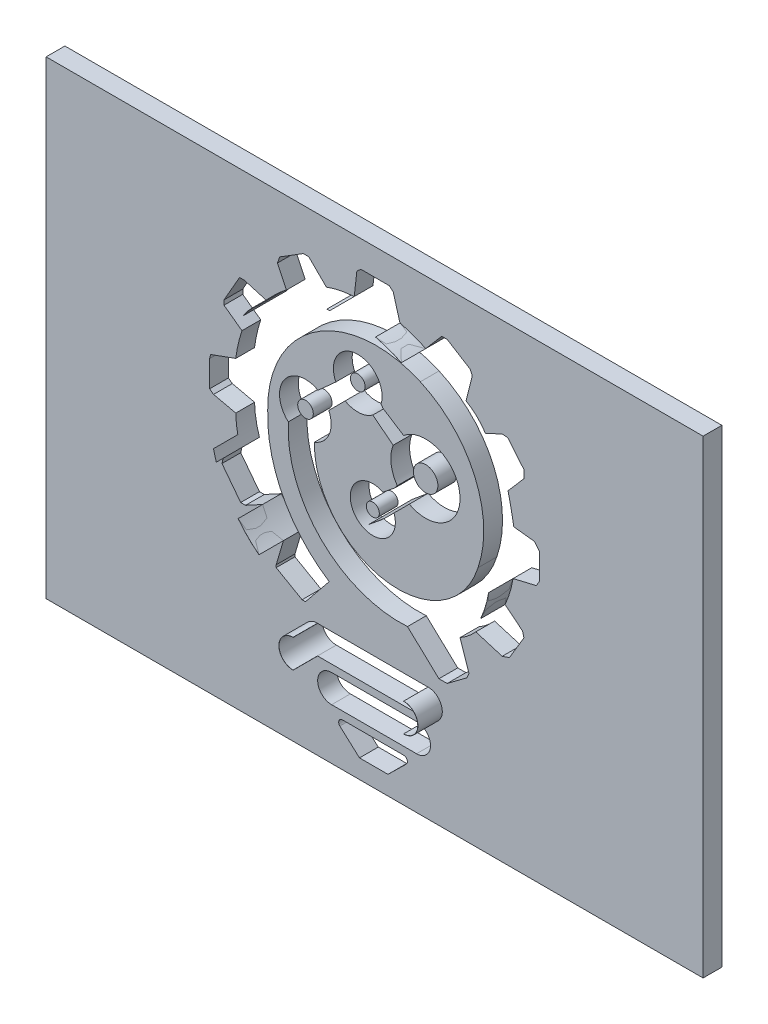
from build123d import *

# Parameters (mm, degrees)
BOSS_EXTRUDE1_DEPTH   = 10
BOSS_EXTRUDE1_2_DEPTH = 10
BOSS_EXTRUDE1_3_DEPTH = 10
SKETCH1_R             = 1.735714146
SKETCH1_R_2           = 3.25388296
SKETCH1_R_3           = 1.963199763
SKETCH1_R_4           = 2.077188844
BOSS_EXTRUDE1_4_DEPTH = 10
CUT_EXTRUDE2_DEPTH    = 3.5
SKETCH3_W             = 175
SKETCH3_H             = 125
BOSS_EXTRUDE2_DEPTH   = 5
CUT_EXTRUDE3_START    = -56
SKETCH4_R             = 2.077188844
SKETCH4_R_2           = 1.963199763
SKETCH4_R_3           = 3.25388296
SKETCH4_R_4           = 1.735714146
CUT_EXTRUDE3_DEPTH    = 56
SKETCH5_W             = 29.451232435
SKETCH5_H             = 6.5
CUT_EXTRUDE4_DEPTH    = 50


with BuildPart() as part:
    # Sketch1 → Boss-Extrude1 (new body)
    with BuildSketch(Plane.XY):
        with BuildLine():
            Line((36.612676513, 50.128115897), (66.063908948, 50.128115897))
            ThreePointArc((66.063908948, 50.128115897), (69.85606523, 46.335959615), (66.063908948, 42.543803333))
            Line((66.063908948, 42.543803333), (36.612676513, 42.543803333))
            ThreePointArc((36.612676513, 42.543803333), (32.82052023, 46.335959615), (36.612676513, 50.128115897))
        make_face()
    extrude(amount=BOSS_EXTRUDE1_DEPTH)



with BuildPart() as body_2:
    # Sketch1 → Boss-Extrude1 2 (new body)
    with BuildSketch(Plane.XY):
        with BuildLine():
            Line((40.371121954, 40.631857622), (62.992183574, 40.631857622))
            ThreePointArc((62.992183574, 40.631857622), (66.703998638, 36.920042558), (62.992183574, 33.208227494))
            Line((62.992183574, 33.208227494), (40.371121954, 33.208227494))
            ThreePointArc((40.371121954, 33.208227494), (36.65930689, 36.920042558), (40.371121954, 40.631857622))
        make_face()
    extrude(amount=BOSS_EXTRUDE1_2_DEPTH)


with BuildPart() as body_3:
    # Sketch1 → Boss-Extrude1 3 (new body)
    with BuildSketch(Plane.XY):
        with BuildLine():
            Line((43.291590681, 31.145459419), (59.548762461, 31.145459419))
            ThreePointArc((59.548762461, 31.145459419), (60.47915555, 30.526270831), (60.255275906, 29.431326214))
            Line((60.255275906, 29.431326214), (55.380256876, 24.642590707))
            Line((55.380256876, 24.642590707), (47.793576713, 24.642590707))
            Line((47.793576713, 24.642590707), (42.554783621, 29.366497269))
            ThreePointArc((42.554783621, 29.366497269), (42.328835394, 30.502145791), (43.291590681, 31.145459419))
        make_face()
    extrude(amount=BOSS_EXTRUDE1_3_DEPTH)


with BuildPart() as body_4:
    # Sketch1 → Boss-Extrude1 4 (new body)
    with BuildSketch(Plane.XY):
        with BuildLine():
            Line((54.042424699, 89.057178574), (57.338263311, 91.74525403))
            Line((57.338263311, 91.74525403), (57.858109934, 92.482001406))
            ThreePointArc((57.858109934, 92.482001406), (56.203750586, 96.735543385), (56.775287603, 101.263552843))
            Line((56.775287603, 101.263552843), (51.33821868, 105.502853511))
            ThreePointArc((51.33821868, 105.502853511), (47.717753365, 104.214223221), (43.975219744, 105.087022863))
            Line((43.975219744, 105.087022863), (39.619407743, 100.731210862))
            ThreePointArc((39.619407743, 100.731210862), (39.726080925, 95.257490785), (35.780591664, 91.461953256))
            ThreePointArc((35.780591664, 91.461953256), (54.470931261, 69.004961782), (79.367543752, 84.29561078))
            ThreePointArc((79.367543752, 84.29561078), (78.518157241, 104.885379157), (63.999024785, 119.509154728))
            ThreePointArc((63.999024785, 119.509154728), (36.348842887, 117.238880972), (23.350287639, 92.729204038))
            ThreePointArc((23.350287639, 92.729204038), (27.391085677, 74.838212259), (39.726172291, 61.263925027))
            Line((39.726172291, 61.263925027), (33.41222021, 53.484864806))
            Line((33.41222021, 53.484864806), (32.501801001, 53.484864806))
            Line((32.501801001, 53.484864806), (25.600419414, 57.431311375))
            Line((25.600419414, 57.431311375), (25.600419414, 58.091089656))
            Line((25.600419414, 58.091089656), (27.529461306, 64.624845993))
            add(Edge.make_bspline(
                [(27.529461306, 64.624845993), (24.51350433, 66.863878585), (21.96798092, 70.186326379)],
                knots=[0, 0, 0, 1, 1, 1], degree=2))
            Line((21.96798092, 70.186326379), (17.44826512, 67.73638598))
            Line((17.44826512, 67.73638598), (16.147653792, 67.73638598))
            Line((16.147653792, 67.73638598), (11.164001938, 74.227807572))
            Line((11.164001938, 74.227807572), (11.478280842, 75.608236048))
            Line((11.478280842, 75.608236048), (16.147653792, 80.277608998))
            add(Edge.make_bspline(
                [(14.836422664, 87.711108712), (14.969965726, 83.721585295), (16.147653792, 80.277608998)],
                knots=[0, 0, 0, 1, 1, 1], degree=2))
            Line((14.836422664, 87.711108712), (8.923989025, 89.057178574))
            Line((8.923989025, 89.057178574), (7.872310913, 89.823022551))
            Line((7.872310913, 89.823022551), (7.872310913, 96.783792065))
            Line((7.872310913, 96.783792065), (8.120139021, 97.872344214))
            Line((8.120139021, 97.872344214), (14.836422664, 100.309725684))
            ThreePointArc((14.836422664, 100.309725684), (15.482642582, 103.966872263), (16.483280209, 107.543329397))
            Line((16.483280209, 107.543329397), (11.70192116, 111.025169506))
            Line((11.70192116, 111.025169506), (11.70192116, 112.254374343))
            Line((11.70192116, 112.254374343), (15.850453276, 119.509154728))
            Line((15.850453276, 119.509154728), (17.116107143, 119.509154728))
            Line((17.116107143, 119.509154728), (23.350287639, 117.668560326))
            add(Edge.make_bspline(
                [(28.34341676, 122.838084344), (25.083188206, 120.541403415), (23.350287639, 117.668560326)],
                knots=[0, 0, 0, 1, 1, 1], degree=2))
            Line((28.34341676, 122.838084344), (25.924430047, 127.860583288))
            Line((25.924430047, 127.860583288), (26.55905403, 129.601522707))
            Line((26.55905403, 129.601522707), (32.835382419, 133.499504209))
            Line((32.835382419, 133.499504209), (34.268559767, 133.499504209))
            Line((34.268559767, 133.499504209), (38.960915607, 128.841575946))
            add(Edge.make_bspline(
                [(46.383652832, 130.361469468), (43.207748731, 130.193389879), (38.960915607, 128.841575946)],
                knots=[0, 0, 0, 1, 1, 1], degree=2))
            Line((46.383652832, 130.361469468), (47.099801145, 136.637538949))
            Line((47.099801145, 136.637538949), (48.204973985, 137.54371488))
            Line((48.204973985, 137.54371488), (55.716804255, 137.54371488))
            Line((55.716804255, 137.54371488), (56.775287603, 136.637538949))
            Line((56.775287603, 136.637538949), (58.560830407, 130.361469468))
            add(Edge.make_bspline(
                [(65.42141471, 127.860583288), (62.762273281, 129.346820645), (58.560830407, 130.361469468)],
                knots=[0, 0, 0, 1, 1, 1], degree=2))
            Line((65.42141471, 127.860583288), (69.703471426, 132.862355649))
            Line((69.703471426, 132.862355649), (71.141353612, 132.862355649))
            Line((71.141353612, 132.862355649), (77.253367018, 129.076282377))
            Line((77.253367018, 129.076282377), (77.838884302, 127.860583288))
            Line((77.838884302, 127.860583288), (76.183025885, 121.169766859))
            add(Edge.make_bspline(
                [(76.183025885, 121.169766859), (79.253811261, 119.413315061), (81.326289538, 116.311143396)],
                knots=[0, 0, 0, 1, 1, 1], degree=2))
            Line((81.326289538, 116.311143396), (81.695672628, 116.410742944))
            Line((81.695672628, 116.410742944), (85.815355288, 118.394906151))
            Line((85.815355288, 118.394906151), (87.360330483, 118.218612472))
            Line((87.360330483, 118.218612472), (91.659132082, 112.975790841))
            Line((91.659132082, 112.975790841), (91.659132082, 111.025169506))
            Line((91.659132082, 111.025169506), (87.360330483, 106.045624317))
            Line((87.360330483, 106.045624317), (88.905274365, 98.500548104))
            Line((88.905274365, 98.500548104), (94.4129898, 97.87207496))
            Line((94.4129898, 97.87207496), (95.767055319, 96.21186062))
            Line((95.767055319, 96.21186062), (95.767055319, 89.382694603))
            Line((95.767055319, 89.382694603), (94.909859849, 87.946746758))
            Line((94.909859849, 87.946746758), (88.683296287, 86.458456895))
            add(Edge.make_bspline(
                [(88.683296287, 86.458456895), (88.100618882, 82.748375774), (86.564981896, 79.397644229)],
                knots=[0, 0, 0, 1, 1, 1], degree=2))
            Line((86.564981896, 79.397644229), (91.245566834, 75.624301928))
            Line((91.245566834, 75.624301928), (91.598019479, 74.227807572))
            Line((91.598019479, 74.227807572), (87.722936412, 67.73638598))
            Line((87.722936412, 67.73638598), (85.815355288, 67.093511057))
            Line((85.815355288, 67.093511057), (78.775745724, 69.205464306))
            add(Edge.make_bspline(
                [(78.775745724, 69.205464306), (76.888993362, 67.188035301), (74.572909919, 65.777644834)],
                knots=[0, 0, 0, 1, 1, 1], degree=2))
            Line((74.572909919, 65.777644834), (76.954362748, 58.711239992))
            Line((76.954362748, 58.711239992), (76.421059157, 57.431311375))
            Line((76.421059157, 57.431311375), (71.141353612, 53.484864806))
            Line((71.141353612, 53.484864806), (68.954808891, 53.484864806))
            Line((68.954808891, 53.484864806), (60.578889007, 61.332051704))
            ThreePointArc((60.578889007, 61.332051704), (37.638360698, 69.85475845), (28.834470871, 92.688853424))
            ThreePointArc((28.834470871, 92.688853424), (27.758447656, 101.854708046), (36.751263907, 103.928345615))
            Line((36.751263907, 103.928345615), (41.493079417, 108.204751423))
            ThreePointArc((41.493079417, 108.204751423), (46.823385651, 117.490522776), (53.542937831, 109.154736511))
            Line((53.542937831, 109.154736511), (54.042232948, 108.423261616))
            Line((54.042232948, 108.423261616), (59.548581239, 104.89051106))
            ThreePointArc((59.548581239, 104.89051106), (74.526662809, 98.789825799), (61.067178135, 89.823022551))
            Line((61.067178135, 89.823022551), (60.090678716, 88.942366655))
            Line((60.090678716, 88.942366655), (56.775372182, 86.238413225))
            ThreePointArc((56.775372182, 86.238413225), (47.03062353, 79.524599219), (54.042424699, 89.057178574))
        make_face()
        with Locations((51.33830326, 83.70113079)):
            Circle(SKETCH1_R, mode=Mode.SUBTRACT)
        with Locations((65.42141471, 97.872141243)):
            Circle(SKETCH1_R_2, mode=Mode.SUBTRACT)
        with Locations((47.333100287, 111.025169506)):
            Circle(SKETCH1_R_3, mode=Mode.SUBTRACT)
        with Locations((33.41222021, 97.872344214)):
            Circle(SKETCH1_R_4, mode=Mode.SUBTRACT)
    extrude(amount=BOSS_EXTRUDE1_4_DEPTH)

    # Sketch2 → Cut-Extrude2 (cut)
    with BuildSketch(Plane(origin=(0, 0, 0), x_dir=(-1, 0, 0), z_dir=(0, 0, -1))):
        with BuildLine():
            Line((-36.882576832, 101.353568923), (-42.290231098, 106.230461342))
            Line((-42.290231098, 106.230461342), (-37.080357203, 101.020587447))
            ThreePointArc((-37.080357203, 101.020587447), (-37.893710893, 96.06046516), (-33.861615538, 93.059371298))
            ThreePointArc((-33.861615538, 93.059371298), (-53.367472026, 67.172595862), (-81.267551741, 83.670751264))
            ThreePointArc((-81.267551741, 83.670751264), (-80.346652287, 105.695765365), (-64.812170652, 121.336391385))
            ThreePointArc((-64.812170652, 121.336391385), (-35.268906863, 118.922417224), (-21.349861224, 92.751978269))
            ThreePointArc((-21.349861224, 92.751978269), (-25.129717063, 74.884715442), (-36.81226348, 60.847461425))
            Line((-36.81226348, 60.847461425), (-32.641490793, 55.708890291))
            Line((-32.641490793, 55.708890291), (-27.799852639, 58.477504958))
            Line((-27.799852639, 58.477504958), (-29.856074316, 65.442025158))
            add(Edge.make_bspline(
                [(-29.856074316, 65.442025158), (-29.175521421, 65.883970458), (-27.879064513, 66.83183634), (-26.00235788, 68.531221621), (-24.519885547, 70.169582429), (-23.383769421, 71.61199016), (-22.824457002, 72.38961669), (-22.555784216, 72.779877494)],
                knots=[0.500282491, 0.500282491, 0.500282491, 0.500282491, 0.500474616, 0.500666741, 0.500858866, 0.500954928, 0.501050991, 0.501050991, 0.501050991, 0.501050991], degree=3))
            Line((-22.555784216, 72.779877494), (-17.0770441, 69.810091883))
            Line((-17.0770441, 69.810091883), (-13.355732604, 74.657260685))
            Line((-13.355732604, 74.657260685), (-18.472416218, 79.773944264))
            add(Edge.make_bspline(
                [(-18.472416218, 79.773944264), (-18.180879786, 80.48416116), (-17.682088455, 81.925076377), (-17.152529334, 84.237432109), (-16.903073855, 86.281021736), (-16.819114201, 87.983569854), (-16.816446117, 88.87065466), (-16.824762225, 89.309605882)],
                knots=[0.500152836, 0.500152836, 0.500152836, 0.500152836, 0.500341207, 0.500529579, 0.500717951, 0.500812137, 0.500906323, 0.500906323, 0.500906323, 0.500906323], degree=3))
            Line((-16.824762225, 89.309605882), (-9.872310913, 90.892454127))
            Line((-9.872310913, 90.892454127), (-9.872310913, 96.380589694))
            Line((-9.872310913, 96.380589694), (-16.688696078, 98.854298633))
            ThreePointArc((-16.688696078, 98.854298633), (-17.459873001, 103.641146011), (-18.868263889, 108.280656412))
            Line((-18.868263889, 108.280656412), (-13.83108217, 111.948789503))
            Line((-13.83108217, 111.948789503), (-16.984161581, 117.462763608))
            Line((-16.984161581, 117.462763608), (-24.362840661, 115.284264699))
            add(Edge.make_bspline(
                [(-24.362840661, 115.284264699), (-24.646652824, 115.933709084), (-25.322213081, 117.159331227), (-26.734958109, 118.921539462), (-28.263474131, 120.307897606), (-29.694417524, 121.359457035), (-30.504172759, 121.879036013), (-30.908098275, 122.122180546)],
                knots=[0.500066259, 0.500066259, 0.500066259, 0.500066259, 0.50030451, 0.500542761, 0.500781012, 0.500900138, 0.501019263, 0.501019263, 0.501019263, 0.501019263], degree=3))
            Line((-30.908098275, 122.122180546), (-28.092433001, 127.968296092))
            Line((-28.092433001, 127.968296092), (-28.20138546, 128.267181157))
            Line((-28.20138546, 128.267181157), (-33.405905009, 131.499504209))
            Line((-33.405905009, 131.499504209), (-33.444443051, 131.499504209))
            Line((-33.444443051, 131.499504209), (-38.424034638, 126.556447474))
            add(Edge.make_bspline(
                [(-38.424034638, 126.556447474), (-38.923711949, 126.728684385), (-39.951259542, 127.065423843), (-41.843524077, 127.61415179), (-44.028521179, 128.110611382), (-45.919655934, 128.349957825), (-47.272276607, 128.396300717), (-47.862527424, 128.375584423), (-48.167409158, 128.352648043)],
                knots=[0.498388849, 0.498388849, 0.498388849, 0.498388849, 0.498504097, 0.498619345, 0.498849841, 0.499080336, 0.499195584, 0.499310832, 0.499310832, 0.499310832, 0.499310832], degree=3))
            Line((-48.167409158, 128.352648043), (-48.98796579, 135.54371488))
            Line((-48.98796579, 135.54371488), (-54.977634657, 135.54371488))
            Line((-54.977634657, 135.54371488), (-55.016607432, 135.51034998))
            Line((-55.016607432, 135.51034998), (-56.961233789, 128.675111375))
            add(Edge.make_bspline(
                [(-56.961233789, 128.675111375), (-57.464027583, 128.566846208), (-58.490262419, 128.328466938), (-60.333224179, 127.828546009), (-62.377183896, 127.133223702), (-64.025150243, 126.370532014), (-65.124626428, 125.721214295), (-65.576552985, 125.405761049), (-65.803735329, 125.231839517)],
                knots=[0.498448059, 0.498448059, 0.498448059, 0.498448059, 0.498564687, 0.498681315, 0.498914572, 0.499147829, 0.499264457, 0.499381086, 0.499381086, 0.499381086, 0.499381086], degree=3))
            Line((-65.803735329, 125.231839517), (-70.606053504, 130.841317314))
            Line((-70.606053504, 130.841317314), (-75.704481358, 127.683107385))
            Line((-75.704481358, 127.683107385), (-75.724393252, 127.641764675))
            Line((-75.724393252, 127.641764675), (-73.857837803, 120.099586634))
            add(Edge.make_bspline(
                [(-73.857837803, 120.099586634), (-74.541582528, 119.803442256), (-75.874683158, 119.090225533), (-77.595265055, 117.741920573), (-78.864618446, 116.344789805), (-79.772400534, 115.062979337), (-80.200086859, 114.348519017), (-80.397886573, 113.989382219)],
                knots=[0.499682977, 0.499682977, 0.499682977, 0.499682977, 0.499917437, 0.500151898, 0.500386359, 0.50050359, 0.50062082, 0.50062082, 0.50062082, 0.50062082], degree=3))
            Line((-80.397886573, 113.989382219), (-82.395941522, 114.528132845))
            Line((-82.395941522, 114.528132845), (-86.162659389, 116.34229758))
            Line((-86.162659389, 116.34229758), (-86.327907229, 116.323441517))
            Line((-86.327907229, 116.323441517), (-89.659132082, 112.260677206))
            Line((-89.659132082, 112.260677206), (-89.659132082, 111.76903796))
            Line((-89.659132082, 111.76903796), (-85.203674476, 106.608029253))
            Line((-85.203674476, 106.608029253), (-87.236979083, 96.67793509))
            Line((-87.236979083, 96.67793509), (-93.377553642, 95.977247801))
            Line((-93.377553642, 95.977247801), (-93.767055319, 95.499681347))
            Line((-93.767055319, 95.499681347), (-93.767055319, 89.934248869))
            Line((-93.767055319, 89.934248869), (-93.624785781, 89.695923256))
            Line((-93.624785781, 89.695923256), (-86.880583793, 88.083906073))
            add(Edge.make_bspline(
                [(-86.880583793, 88.083906073), (-86.793282577, 87.265096209), (-86.541207507, 85.621978009), (-85.946675868, 83.278937952), (-85.13382938, 81.017695887), (-84.440269594, 79.557543904), (-84.0602914, 78.847872764)],
                knots=[0.499526309, 0.499526309, 0.499526309, 0.499526309, 0.499704733, 0.499883157, 0.500061581, 0.500240005, 0.500240005, 0.500240005, 0.500240005], degree=3))
            Line((-84.0602914, 78.847872764), (-89.438495275, 74.512131731))
            Line((-89.438495275, 74.512131731), (-86.384253109, 69.395757914))
            Line((-86.384253109, 69.395757914), (-85.780104848, 69.192153589))
            Line((-85.780104848, 69.192153589), (-78.120866305, 71.490001727))
            add(Edge.make_bspline(
                [(-78.120866305, 71.490001727), (-77.70493696, 70.985012906), (-76.813481759, 70.007181831), (-75.383303928, 68.738229754), (-73.836976644, 67.634539742), (-72.716715394, 67.005220365), (-72.144124713, 66.722015581)],
                knots=[0.499572208, 0.499572208, 0.499572208, 0.499572208, 0.499740941, 0.499909675, 0.500078408, 0.500247141, 0.500247141, 0.500247141, 0.500247141], degree=3))
            Line((-72.144124713, 66.722015581), (-74.818735212, 58.785733908))
            Line((-74.818735212, 58.785733908), (-74.785364314, 58.705643751))
            Line((-74.785364314, 58.705643751), (-70.476484374, 55.484864806))
            Line((-70.476484374, 55.484864806), (-69.745318874, 55.484864806))
            Line((-69.745318874, 55.484864806), (-61.298146946, 63.398805937))
            ThreePointArc((-61.298146946, 63.398805937), (-38.969943576, 71.350920957), (-30.910982586, 93.64078293))
            ThreePointArc((-30.910982586, 93.64078293), (-29.525503748, 100.881619161), (-36.882576832, 101.353568923))
        make_face()
    extrude(amount=-CUT_EXTRUDE2_DEPTH, mode=Mode.SUBTRACT)


with BuildPart() as part_1:
    add(part.part)

    add(body_2.part)  # Boss-Extrude2 merges body 2

    add(body_3.part)  # Boss-Extrude2 merges body 3

    add(body_4.part)  # Boss-Extrude2 merges body 4
    # Sketch3 → Boss-Extrude2 (add)
    with BuildSketch(Plane(origin=(0, 0, 3.5), x_dir=(-1, 0, 0), z_dir=(0, 0, -1))):
        with Locations((-51.822055319, 82.130763027)):
            Rectangle(SKETCH3_W, SKETCH3_H)
    extrude(amount=BOSS_EXTRUDE2_DEPTH)

    # Sketch4 → Cut-Extrude3 (cut)
    # profile 1 of 4: a face of its own
    with BuildSketch(Plane.XY.offset(10).offset(CUT_EXTRUDE3_START)):
        with BuildLine():
            Line((95.767055319, 96.21186062), (95.767055319, 89.382694603))
            Line((95.767055319, 89.382694603), (94.909859849, 87.946746758))
            Line((94.909859849, 87.946746758), (88.683296287, 86.458456895))
            ThreePointArc((88.683296287, 86.458456895), (87.851237864, 82.85991866), (86.564981896, 79.397644229))
            Line((86.564981896, 79.397644229), (91.245566834, 75.624301928))
            Line((91.245566834, 75.624301928), (91.598019479, 74.227807572))
            Line((91.598019479, 74.227807572), (87.722936412, 67.73638598))
            Line((87.722936412, 67.73638598), (85.815355288, 67.093511057))
            Line((85.815355288, 67.093511057), (78.775745724, 69.205464306))
            ThreePointArc((78.775745724, 69.205464306), (76.813139121, 67.321358589), (74.572909919, 65.777644834))
            Line((74.572909919, 65.777644834), (76.954362748, 58.711239992))
            Line((76.954362748, 58.711239992), (76.421059157, 57.431311375))
            Line((76.421059157, 57.431311375), (71.141353612, 53.484864806))
            Line((71.141353612, 53.484864806), (68.954808891, 53.484864806))
            Line((68.954808891, 53.484864806), (60.578889007, 61.332051704))
            ThreePointArc((60.578889007, 61.332051704), (37.638360698, 69.85475845), (28.834470871, 92.688853424))
            ThreePointArc((28.834470871, 92.688853424), (27.758447656, 101.854708046), (36.751263907, 103.928345615))
            Line((36.751263907, 103.928345615), (41.493079417, 108.204751423))
            ThreePointArc((41.493079417, 108.204751423), (46.823385651, 117.490522776), (53.542937831, 109.154736511))
            Line((53.542937831, 109.154736511), (54.042232948, 108.423261616))
            Line((54.042232948, 108.423261616), (59.548581239, 104.89051106))
            ThreePointArc((59.548581239, 104.89051106), (74.526662809, 98.789825799), (61.067178135, 89.823022551))
            Line((61.067178135, 89.823022551), (56.775372182, 86.238413225))
            ThreePointArc((56.775372182, 86.238413225), (47.03062353, 79.524599219), (54.042424699, 89.057178574))
            Line((54.042424699, 89.057178574), (57.338263311, 91.74525403))
            Line((57.338263311, 91.74525403), (57.858109934, 92.482001406))
            ThreePointArc((57.858109934, 92.482001406), (56.203750586, 96.735543385), (56.775287603, 101.263552843))
            Line((56.775287603, 101.263552843), (51.33821868, 105.502853511))
            ThreePointArc((51.33821868, 105.502853511), (47.717753365, 104.214223221), (43.975219744, 105.087022863))
            Line((43.975219744, 105.087022863), (39.619407743, 100.731210862))
            ThreePointArc((39.619407743, 100.731210862), (39.726080925, 95.257490785), (35.780591664, 91.461953256))
            ThreePointArc((35.780591664, 91.461953256), (54.470931261, 69.004961782), (79.367543752, 84.29561078))
            ThreePointArc((79.367543752, 84.29561078), (78.518157241, 104.885379157), (63.999024785, 119.509154728))
            ThreePointArc((63.999024785, 119.509154728), (36.348842887, 117.238880972), (23.350287639, 92.729204038))
            ThreePointArc((23.350287639, 92.729204038), (27.391085677, 74.838212259), (39.726172291, 61.263925027))
            Line((39.726172291, 61.263925027), (33.41222021, 53.484864806))
            Line((33.41222021, 53.484864806), (32.501801001, 53.484864806))
            Line((32.501801001, 53.484864806), (25.600419414, 57.431311375))
            Line((25.600419414, 57.431311375), (25.600419414, 58.091089656))
            Line((25.600419414, 58.091089656), (27.529461306, 64.624845993))
            ThreePointArc((27.529461306, 64.624845993), (24.572591537, 67.229456611), (21.96798092, 70.186326379))
            Line((21.96798092, 70.186326379), (17.44826512, 67.73638598))
            Line((17.44826512, 67.73638598), (16.147653792, 67.73638598))
            Line((16.147653792, 67.73638598), (11.164001938, 74.227807572))
            Line((11.164001938, 74.227807572), (11.478280842, 75.608236048))
            Line((11.478280842, 75.608236048), (16.147653792, 80.277608998))
            ThreePointArc((16.147653792, 80.277608998), (15.212501807, 83.945050067), (14.836422664, 87.711108712))
            Line((14.836422664, 87.711108712), (8.923989025, 89.057178574))
            Line((8.923989025, 89.057178574), (7.872310913, 89.823022551))
            Line((7.872310913, 89.823022551), (7.872310913, 96.783792065))
            Line((7.872310913, 96.783792065), (8.120139021, 97.872344214))
            Line((8.120139021, 97.872344214), (14.836422664, 100.309725684))
            ThreePointArc((14.836422664, 100.309725684), (15.482642582, 103.966872263), (16.483280209, 107.543329397))
            Line((16.483280209, 107.543329397), (11.70192116, 111.025169506))
            Line((11.70192116, 111.025169506), (11.70192116, 112.254374343))
            Line((11.70192116, 112.254374343), (15.850453276, 119.509154728))
            Line((15.850453276, 119.509154728), (17.116107143, 119.509154728))
            Line((17.116107143, 119.509154728), (23.350287639, 117.668560326))
            ThreePointArc((23.350287639, 117.668560326), (25.595126092, 120.496459025), (28.34341676, 122.838084344))
            Line((28.34341676, 122.838084344), (25.924430047, 127.860583288))
            Line((25.924430047, 127.860583288), (26.55905403, 129.601522707))
            Line((26.55905403, 129.601522707), (32.835382419, 133.499504209))
            Line((32.835382419, 133.499504209), (34.268559767, 133.499504209))
            Line((34.268559767, 133.499504209), (38.960915607, 128.841575946))
            ThreePointArc((38.960915607, 128.841575946), (42.617932094, 129.866963371), (46.383652832, 130.361469468))
            Line((46.383652832, 130.361469468), (47.099801145, 136.637538949))
            Line((47.099801145, 136.637538949), (48.204973985, 137.54371488))
            Line((48.204973985, 137.54371488), (55.716804255, 137.54371488))
            Line((55.716804255, 137.54371488), (56.775287603, 136.637538949))
            Line((56.775287603, 136.637538949), (58.560830407, 130.361469468))
            ThreePointArc((58.560830407, 130.361469468), (62.061312636, 129.303576101), (65.42141471, 127.860583288))
            Line((65.42141471, 127.860583288), (69.703471426, 132.862355649))
            Line((69.703471426, 132.862355649), (71.141353612, 132.862355649))
            Line((71.141353612, 132.862355649), (77.253367018, 129.076282377))
            Line((77.253367018, 129.076282377), (77.838884302, 127.860583288))
            Line((77.838884302, 127.860583288), (76.183025885, 121.169766859))
            ThreePointArc((76.183025885, 121.169766859), (79.046866549, 119.049782883), (81.326289538, 116.311143396))
            Line((81.326289538, 116.311143396), (81.695672628, 116.410742944))
            Line((81.695672628, 116.410742944), (85.815355288, 118.394906151))
            Line((85.815355288, 118.394906151), (87.360330483, 118.218612472))
            Line((87.360330483, 118.218612472), (91.659132082, 112.975790841))
            Line((91.659132082, 112.975790841), (91.659132082, 111.025169506))
            Line((91.659132082, 111.025169506), (87.360330483, 106.045624317))
            ThreePointArc((87.360330483, 106.045624317), (88.18952067, 102.284699945), (88.905274365, 98.500548104))
            Line((88.905274365, 98.500548104), (94.4129898, 97.87207496))
            Line((94.4129898, 97.87207496), (95.767055319, 96.21186062))
        make_face()
        with Locations((33.41222021, 97.872344214)):
            Circle(SKETCH4_R, mode=Mode.SUBTRACT)
        with Locations((47.333100287, 111.025169506)):
            Circle(SKETCH4_R_2, mode=Mode.SUBTRACT)
        with Locations((65.42141471, 97.872141243)):
            Circle(SKETCH4_R_3, mode=Mode.SUBTRACT)
        with Locations((51.33830326, 83.70113079)):
            Circle(SKETCH4_R_4, mode=Mode.SUBTRACT)
    # profile 2 of 4: a face of its own
    with BuildSketch(Plane.XY.offset(10).offset(CUT_EXTRUDE3_START)):
        with BuildLine():
            Line((55.380256876, 24.642590707), (47.793576713, 24.642590707))
            Line((47.793576713, 24.642590707), (42.554783621, 29.366497269))
            ThreePointArc((42.554783621, 29.366497269), (42.328835394, 30.502145791), (43.291590681, 31.145459419))
            Line((43.291590681, 31.145459419), (59.548762461, 31.145459419))
            ThreePointArc((59.548762461, 31.145459419), (60.475775661, 30.524877743), (60.255275906, 29.431326214))
            Line((60.255275906, 29.431326214), (55.380256876, 24.642590707))
        make_face()
    # profile 3 of 4: a face of its own
    with BuildSketch(Plane.XY.offset(10).offset(CUT_EXTRUDE3_START)):
        with BuildLine():
            Line((66.063908948, 42.575563047), (36.612676513, 42.575563047))
            ThreePointArc((36.612676513, 42.575563047), (32.852795459, 46.3354441), (36.612676513, 50.095325154))
            Line((36.612676513, 50.095325154), (66.063908948, 50.095325154))
            ThreePointArc((66.063908948, 50.095325154), (69.823790002, 46.3354441), (66.063908948, 42.575563047))
        make_face()
    # profile 4 of 4: a face of its own
    with BuildSketch(Plane.XY.offset(10).offset(CUT_EXTRUDE3_START)):
        with BuildLine():
            Line((62.992183574, 33.204893743), (40.371121954, 33.204893743))
            ThreePointArc((40.371121954, 33.204893743), (36.65597314, 36.920042558), (40.371121954, 40.635191373))
            Line((40.371121954, 40.635191373), (62.992183574, 40.635191373))
            ThreePointArc((62.992183574, 40.635191373), (66.707332388, 36.920042558), (62.992183574, 33.204893743))
        make_face()
    extrude(amount=CUT_EXTRUDE3_DEPTH, mode=Mode.SUBTRACT)


with BuildPart() as cut_extrude3_piece_1:
    # of the separate pieces the step leaves, piece 1, a body of its own (cut_extrude3_pieces)
    add(part_1.part.solids().sort_by_distance((66.063908948, 50.128115897, 3.5))[0])

    # Sketch5 → Cut-Extrude4 (cut)
    with BuildSketch(Plane(origin=(0, 50.128115897, 0), x_dir=(1, 0, 0), z_dir=(0, 1, 0))):
        with Locations((51.338292731, -6.75)):
            Rectangle(SKETCH5_W, SKETCH5_H)
    extrude(amount=-CUT_EXTRUDE4_DEPTH, mode=Mode.SUBTRACT)


with BuildPart() as cut_extrude3_piece_2:
    # of the separate pieces the step leaves, piece 2, a body of its own (cut_extrude3_pieces)
    add(part_1.part.solids().sort_by_distance((68.67529767, 97.872141243, -1.5))[0])


with BuildPart() as cut_extrude3_piece_3:
    # of the separate pieces the step leaves, piece 3, a body of its own (cut_extrude3_pieces)
    add(part_1.part.solids().sort_by_distance((35.489409053, 97.872344214, -1.5))[0])


with BuildPart() as cut_extrude3_piece_4:
    # of the separate pieces the step leaves, piece 4, a body of its own (cut_extrude3_pieces)
    add(part_1.part.solids().sort_by_distance((49.29630005, 111.025169506, -1.5))[0])


with BuildPart() as cut_extrude3_piece_5:
    # of the separate pieces the step leaves, piece 5, a body of its own (cut_extrude3_pieces)
    add(part_1.part.solids().sort_by_distance((53.074017406, 83.70113079, -1.5))[0])


solid = Compound([cut_extrude3_piece_1.part, cut_extrude3_piece_2.part, cut_extrude3_piece_3.part, cut_extrude3_piece_4.part, cut_extrude3_piece_5.part])
